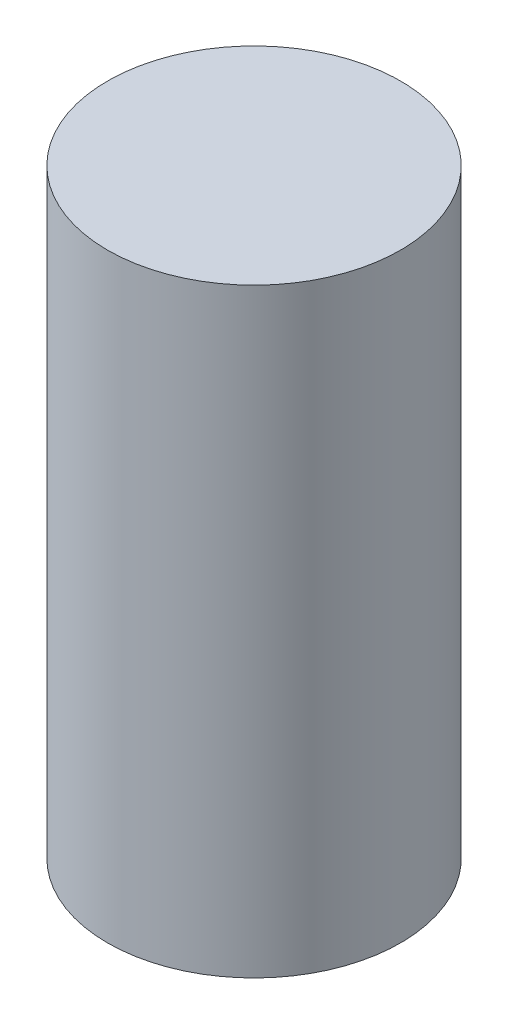
from build123d import *

# Parameters (mm, degrees)
SKETCH1_R           = 31.5
BOSS_EXTRUDE1_DEPTH = 129


with BuildPart() as part:
    # Sketch1 → Boss-Extrude1 (new body)
    with BuildSketch(Plane(origin=(0, 0, 0), x_dir=(1, 0, 0), z_dir=(0, 1, 0))):
        with Locations(Location((0, 0, 0), (0, 0, 270))):
            Circle(SKETCH1_R)
    extrude(amount=BOSS_EXTRUDE1_DEPTH)


solid = part.part
